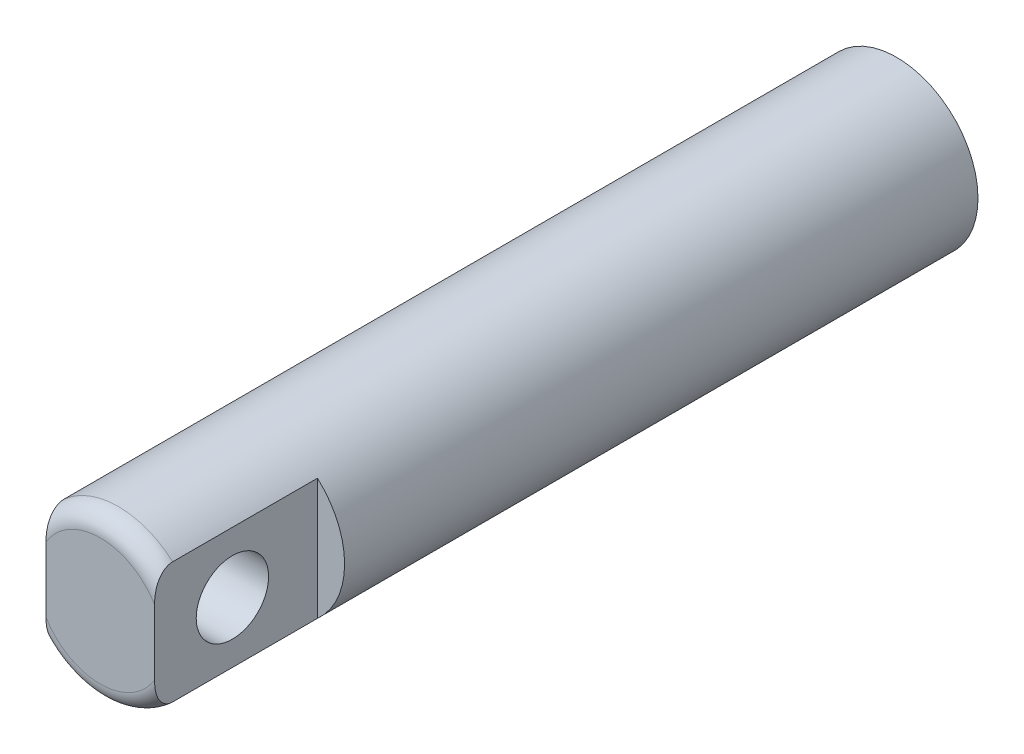
from build123d import *

# Parameters (mm, degrees)
SKETCH_1_R          = 4.5
EXTRUDE_1_DEPTH     = 35
SKETCH_2_W          = 6
SKETCH_2_H          = 6.708203932
EXTRUDE_2_DEPTH     = 9
SKETCH_3_R          = 2
CUT_EXTRUDE_1_DEPTH = 45.860896112
FILLET_1_R          = 1


with BuildPart() as part:
    # Эскиз1 → Бобышка-Вытянуть1 (new body)
    with BuildSketch(Plane.XY):
        Circle(SKETCH_1_R)
    extrude(amount=EXTRUDE_1_DEPTH)

    # Эскиз2 → Бобышка-Вытянуть2 (add)
    with BuildSketch(Plane.XY.offset(35)):
        with BuildLine():
            Line((-3, 3.354101966), (3, 3.354101966))
            ThreePointArc((3, 3.354101966), (0, 4.5), (-3, 3.354101966))
        make_face()
        Rectangle(SKETCH_2_W, SKETCH_2_H)
        with BuildLine():
            ThreePointArc((-3, -3.354101966), (0, -4.5), (3, -3.354101966))
            Line((3, -3.354101966), (-3, -3.354101966))
        make_face()
    extrude(amount=EXTRUDE_2_DEPTH)

    # Эскиз3 → Вырез-Вытянуть1 (cut, through all)
    with BuildSketch(Plane.ZY.offset(3)):
        with Locations((39.7, 0)):
            Circle(SKETCH_3_R)
    extrude(amount=-CUT_EXTRUDE_1_DEPTH, mode=Mode.SUBTRACT)

    # Скругление1
    fillet_1_edges = [part.edges().sort_by_distance(p)[0] for p in [
        (0, 4.5, 44),
        (0, -4.5, 44),
    ]]
    fillet(fillet_1_edges, radius=FILLET_1_R)


solid = part.part
